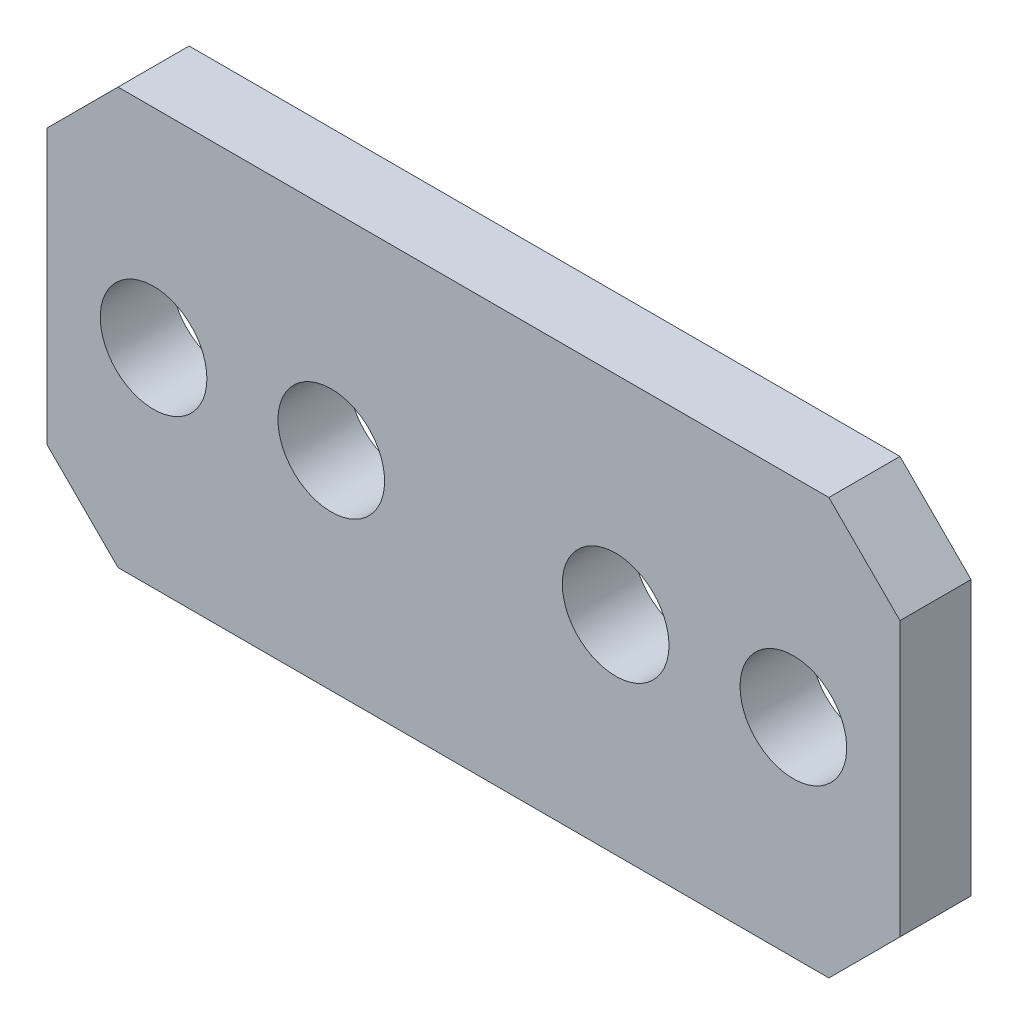
from build123d import *

# Parameters (mm, degrees)
SKETCH1_W           = 24
SKETCH1_H           = 11.708497378
SKETCH1_R           = 1.5
BOSS_EXTRUDE1_DEPTH = 2
CHAMFER1_SIZE       = 2


with BuildPart() as part:
    # Sketch1 → Boss-Extrude1 (new body)
    with BuildSketch(Plane.XY):
        Rectangle(SKETCH1_W, SKETCH1_H)
        with Locations((-9, 0)):
            Circle(SKETCH1_R, mode=Mode.SUBTRACT)
        with Locations((-4, 0)):
            Circle(SKETCH1_R, mode=Mode.SUBTRACT)
        with Locations(Location((4, 0, 0), (0, 0, 180))):
            Circle(SKETCH1_R, mode=Mode.SUBTRACT)
        with Locations(Location((9, 0, 0), (0, 0, 180))):
            Circle(SKETCH1_R, mode=Mode.SUBTRACT)
    extrude(amount=BOSS_EXTRUDE1_DEPTH)

    # Chamfer1
    chamfer1_edges = [part.edges().sort_by_distance(p)[0] for p in [
        (12, -5.854248689, 1),
        (-12, -5.854248689, 1),
        (-12, 5.854248689, 1),
        (12, 5.854248689, 1),
    ]]
    chamfer(chamfer1_edges, length=CHAMFER1_SIZE)


solid = part.part
